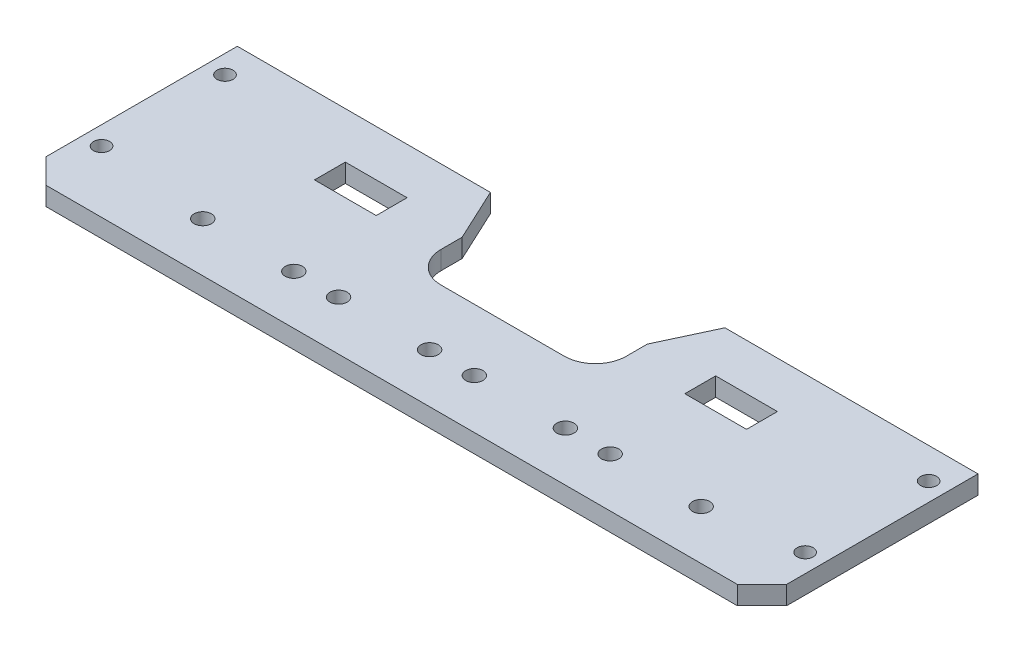
from build123d import *

# Parameters (mm, degrees)
SKETCH_1_W          = 120
SKETCH_1_H          = 35
EXTRUDE_1_DEPTH     = 3
SKETCH_2_W          = 30
SKETCH_2_H          = 17
CUT_EXTRUDE_1_DEPTH = 63.571958576
SKETCH_3_R          = 1.3
CUT_EXTRUDE_2_DEPTH = 63.571958576
SKETCH_4_R          = 1.4
CUT_EXTRUDE_3_DEPTH = 63.571958576
SKETCH_5_W          = 10
SKETCH_5_H          = 5
CUT_EXTRUDE_4_DEPTH = 63.571958576
CHAMFER_1_SIZE      = 4
CHAMFER_1_SIZE2     = 8.578027682
CHAMFER_2_SIZE      = 4
CHAMFER_2_SIZE2     = 8.578027682
FILLET_1_R          = 5
CHAMFER_3_SIZE      = 4


with BuildPart() as part:
    # 草图1 → 凸台-拉伸1 (new body)
    with BuildSketch(Plane(origin=(0, 0, 0), x_dir=(1, 0, 0), z_dir=(0, 1, 0))):
        Rectangle(SKETCH_1_W, SKETCH_1_H)
    extrude(amount=EXTRUDE_1_DEPTH)

    # 草图2 → 切除-拉伸1 (cut, through all)
    with BuildSketch(Plane(origin=(0, 3, 0), x_dir=(1, 0, 0), z_dir=(0, 1, 0))):
        with Locations((0, 9)):
            Rectangle(SKETCH_2_W, SKETCH_2_H)
    extrude(amount=-CUT_EXTRUDE_1_DEPTH, mode=Mode.SUBTRACT)

    # 草图3 → 切除-拉伸2 (cut, through all)
    with BuildSketch(Plane(origin=(0, 3, 0), x_dir=(1, 0, 0), z_dir=(0, 1, 0))):
        with Locations(Location((-57, 12.5, 0), (0, 0, 270))):
            Circle(SKETCH_3_R)
        with Locations(Location((-57, -7.5, 0), (0, 0, 270))):
            Circle(SKETCH_3_R)
        with Locations(Location((57, -7.5, 0), (0, 0, 90))):
            Circle(SKETCH_3_R)
        with Locations(Location((57, 12.5, 0), (0, 0, 90))):
            Circle(SKETCH_3_R)
    extrude(amount=-CUT_EXTRUDE_2_DEPTH, mode=Mode.SUBTRACT)

    # 草图4 → 切除-拉伸3 (cut, through all)
    with BuildSketch(Plane(origin=(0, 3, 0), x_dir=(1, 0, 0), z_dir=(0, 1, 0))):
        with Locations(Location((5.4, -9.5, 0), (0, 0, 270))):
            Circle(SKETCH_4_R)
        with Locations(Location((20.15, -9.5, 0), (0, 0, 270))):
            Circle(SKETCH_4_R)
        with Locations(Location((27.4, -9.5, 0), (0, 0, 270))):
            Circle(SKETCH_4_R)
        with Locations(Location((42.15, -9.5, 0), (0, 0, 270))):
            Circle(SKETCH_4_R)
        with Locations(Location((-1.85, -9.5, 0), (0, 0, 270))):
            Circle(SKETCH_4_R)
        with Locations(Location((-16.6, -9.5, 0), (0, 0, 270))):
            Circle(SKETCH_4_R)
        with Locations(Location((-23.85, -9.5, 0), (0, 0, 270))):
            Circle(SKETCH_4_R)
        with Locations(Location((-38.6, -9.5, 0), (0, 0, 270))):
            Circle(SKETCH_4_R)
    extrude(amount=-CUT_EXTRUDE_3_DEPTH, mode=Mode.SUBTRACT)

    # 草图5 → 切除-拉伸4 (cut, through all)
    with BuildSketch(Plane(origin=(0, 3, 0), x_dir=(1, 0, 0), z_dir=(0, 1, 0))):
        with Locations((-30, 7.5)):
            Rectangle(SKETCH_5_W, SKETCH_5_H)
        with Locations((30, 7.5)):
            Rectangle(SKETCH_5_W, SKETCH_5_H)
    extrude(amount=-CUT_EXTRUDE_4_DEPTH, mode=Mode.SUBTRACT)

    # 倒角1
    chamfer_1_edges = [part.edges().sort_by_distance(p)[0] for p in [
        (-15, 1.5, -17.5),
    ]]
    chamfer_1_side = [part.faces().sort_by_distance(p)[0] for p in [
        (-37.5, 1.5, -17.5),
    ]]
    chamfer(chamfer_1_edges, length=CHAMFER_1_SIZE, length2=CHAMFER_1_SIZE2, reference=chamfer_1_side[0])

    # 倒角2
    chamfer_2_edges = [part.edges().sort_by_distance(p)[0] for p in [
        (15, 1.5, -17.5),
    ]]
    chamfer_2_side = [part.faces().sort_by_distance(p)[0] for p in [
        (37.5, 1.5, -17.5),
    ]]
    chamfer(chamfer_2_edges, length=CHAMFER_2_SIZE, length2=CHAMFER_2_SIZE2, reference=chamfer_2_side[0])

    # 圆角1
    fillet_1_edges = [part.edges().sort_by_distance(p)[0] for p in [
        (-15, 1.5, -0.5),
        (15, 1.5, -0.5),
    ]]
    fillet(fillet_1_edges, radius=FILLET_1_R)

    # 倒角3
    chamfer_3_edges = [part.edges().sort_by_distance(p)[0] for p in [
        (60, 1.5, 17.5),
        (-60, 1.5, 17.5),
    ]]
    chamfer(chamfer_3_edges, length=CHAMFER_3_SIZE)


solid = part.part
